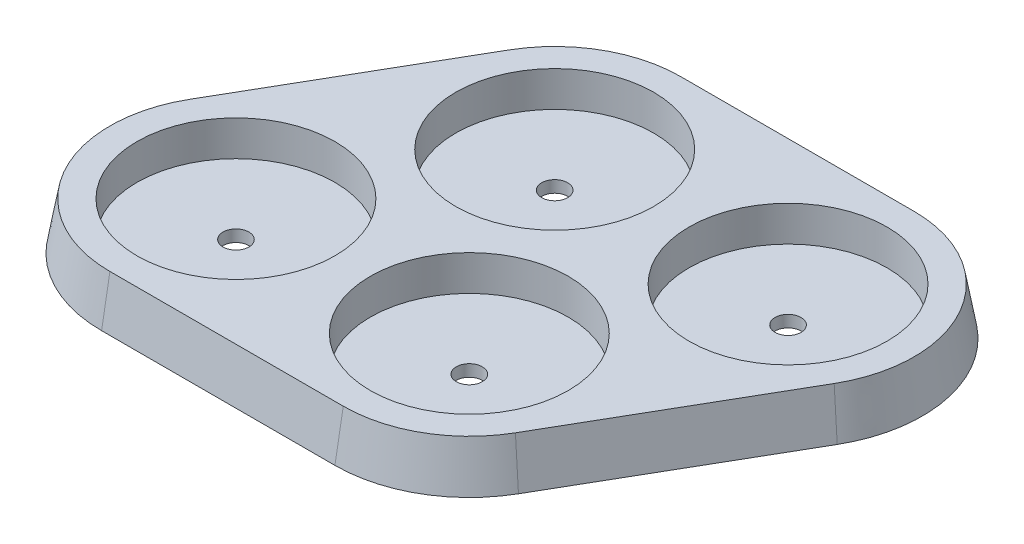
from build123d import *

# Parameters (mm, degrees)
BOSS_EXTRUDE1_DEPTH = 4
BOSS_EXTRUDE1_TAPER = 10
CUT_EXTRUDE1_START  = 4
SKETCH1_3_R         = 1.1
CUT_EXTRUDE1_DEPTH  = 4
CUT_EXTRUDE2_START  = 4
SKETCH1_4_R         = 8.4
SKETCH1_4_R_2       = 1.1
CUT_EXTRUDE2_DEPTH  = 3


with BuildPart() as part:
    # Sketch1 → Boss-Extrude1 (new body)
    with BuildSketch(Plane(origin=(0, 0, 0), x_dir=(1, 0, 0), z_dir=(0, 1, 0))):
        with BuildLine():
            ThreePointArc((-19.8, 11.4), (-25.5, 9.872689603), (-29.672689603, 5.7))
            Line((-29.672689603, 5.7), (-39.572689603, -11.447302995))
            ThreePointArc((-39.572689603, -11.447302995), (-39.572689603, -22.847302995), (-29.7, -28.547302995))
            Line((-29.7, -28.547302995), (-9.9, -28.547302995))
            ThreePointArc((-9.9, -28.547302995), (-4.2, -27.019992598), (-0.027310397, -22.847302995))
            Line((-0.027310397, -22.847302995), (9.872689603, -5.7))
            ThreePointArc((9.872689603, -5.7), (9.872689603, 5.7), (0, 11.4))
            Line((0, 11.4), (-19.8, 11.4))
        make_face()
    extrude(amount=BOSS_EXTRUDE1_DEPTH, taper=BOSS_EXTRUDE1_TAPER)

    # Sketch1<3> → Cut-Extrude1 (cut)
    with BuildSketch(Plane(origin=(0, 0, 0), x_dir=(1, 0, 0), z_dir=(0, 1, 0)).offset(CUT_EXTRUDE1_START)):
        with Locations(Location((-9.9, -17.147302995, 0), (0, 0, 270))):
            Circle(SKETCH1_3_R)
        with Locations(Location((0, 0, 0), (0, 0, 270))):
            Circle(SKETCH1_3_R)
        with Locations(Location((-29.7, -17.147302995, 0), (0, 0, 270))):
            Circle(SKETCH1_3_R)
        with Locations(Location((-19.8, 0, 0), (0, 0, 270))):
            Circle(SKETCH1_3_R)
    extrude(amount=-CUT_EXTRUDE1_DEPTH, mode=Mode.SUBTRACT)

    # Sketch1<4> → Cut-Extrude2 (cut)
    # profile 1 of 4: a face of its own
    with BuildSketch(Plane(origin=(0, 0, 0), x_dir=(1, 0, 0), z_dir=(0, 1, 0)).offset(CUT_EXTRUDE2_START)):
        with Locations(Location((-19.8, 0, 0), (0, 0, 270))):
            Circle(SKETCH1_4_R)
        with Locations(Location((-19.8, 0, 0), (0, 0, 270))):
            Circle(SKETCH1_4_R_2, mode=Mode.SUBTRACT)
    # profile 2 of 4: a face of its own
    with BuildSketch(Plane(origin=(0, 0, 0), x_dir=(1, 0, 0), z_dir=(0, 1, 0)).offset(CUT_EXTRUDE2_START)):
        with Locations(Location((-9.9, -17.147302995, 0), (0, 0, 270))):
            Circle(SKETCH1_4_R)
        with Locations(Location((-9.9, -17.147302995, 0), (0, 0, 270))):
            Circle(SKETCH1_4_R_2, mode=Mode.SUBTRACT)
    # profile 3 of 4: a face of its own
    with BuildSketch(Plane(origin=(0, 0, 0), x_dir=(1, 0, 0), z_dir=(0, 1, 0)).offset(CUT_EXTRUDE2_START)):
        with Locations(Location((0, 0, 0), (0, 0, 270))):
            Circle(SKETCH1_4_R)
        with Locations(Location((0, 0, 0), (0, 0, 270))):
            Circle(SKETCH1_4_R_2, mode=Mode.SUBTRACT)
    # profile 4 of 4: a face of its own
    with BuildSketch(Plane(origin=(0, 0, 0), x_dir=(1, 0, 0), z_dir=(0, 1, 0)).offset(CUT_EXTRUDE2_START)):
        with Locations(Location((-29.7, -17.147302995, 0), (0, 0, 270))):
            Circle(SKETCH1_4_R)
        with Locations(Location((-29.7, -17.147302995, 0), (0, 0, 270))):
            Circle(SKETCH1_4_R_2, mode=Mode.SUBTRACT)
    extrude(amount=-CUT_EXTRUDE2_DEPTH, mode=Mode.SUBTRACT)


solid = part.part
